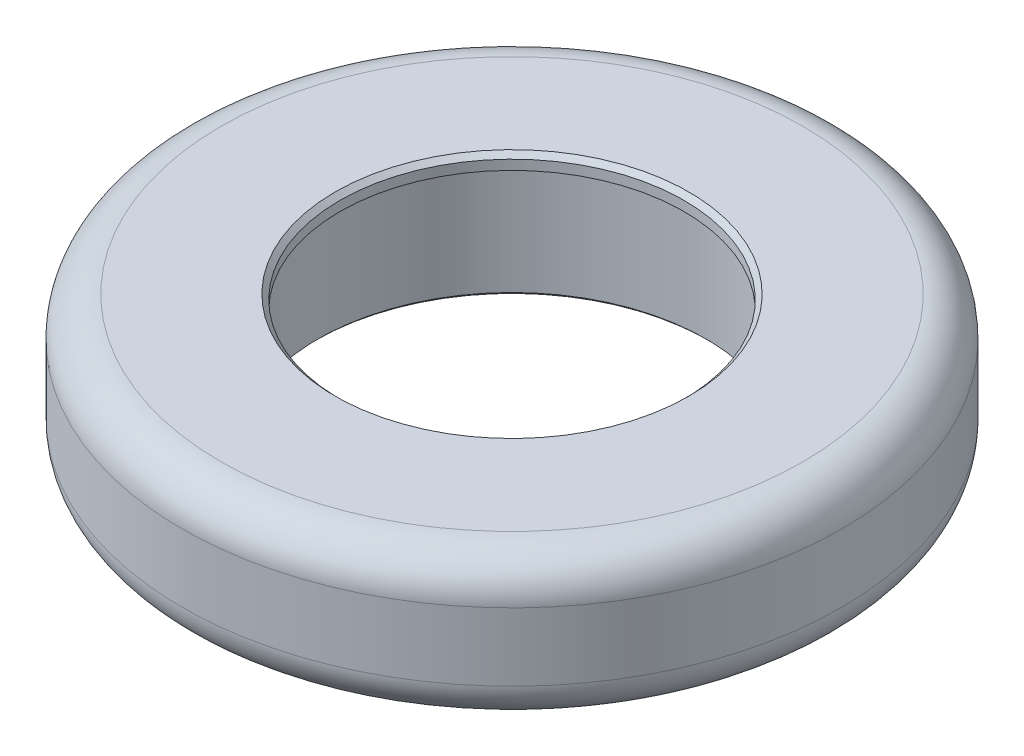
from build123d import *

# Parameters (mm, degrees)
RACCORDO1_R  = 4
SMUSSO1_SIZE = 0.5
SMUSSO2_SIZE = 0.3
RACCORDO5_R  = 0.8


with BuildPart() as part:
    # Schizzo1 → Rivoluzione1 (revolve)
    with BuildSketch(Plane.XY):
        Polygon((-34, -19.165655205), (-34, -34.165655205), (-23.25, -34.165655205), (-22.25, -33.465655205), (-20, -33.465655205), (-20, -20.665655205), (-17.75, -20.665655205), (-17.75, -19.165655205), align=None)
    revolve(axis=Axis((0, 44.110898502, 0), (0, -1, 0)))

    # Raccordo1
    raccordo1_edges = [part.edges().sort_by_distance(p)[0] for p in [
        (34, -34.165655205, 0),
        (34, -19.165655205, 0),
    ]]
    fillet(raccordo1_edges, radius=RACCORDO1_R)

    # Smusso1
    smusso1_edges = [part.edges().sort_by_distance(p)[0] for p in [
        (17.75, -19.165655205, 0),
    ]]
    chamfer(smusso1_edges, length=SMUSSO1_SIZE)

    # Smusso2
    smusso2_edges = [part.edges().sort_by_distance(p)[0] for p in [
        (20, -33.465655205, 0),
    ]]
    chamfer(smusso2_edges, length=SMUSSO2_SIZE)

    # Raccordo5
    raccordo5_edges = [part.edges().sort_by_distance(p)[0] for p in [
        (20, -20.665655205, 0),
    ]]
    fillet(raccordo5_edges, radius=RACCORDO5_R)


solid = part.part
